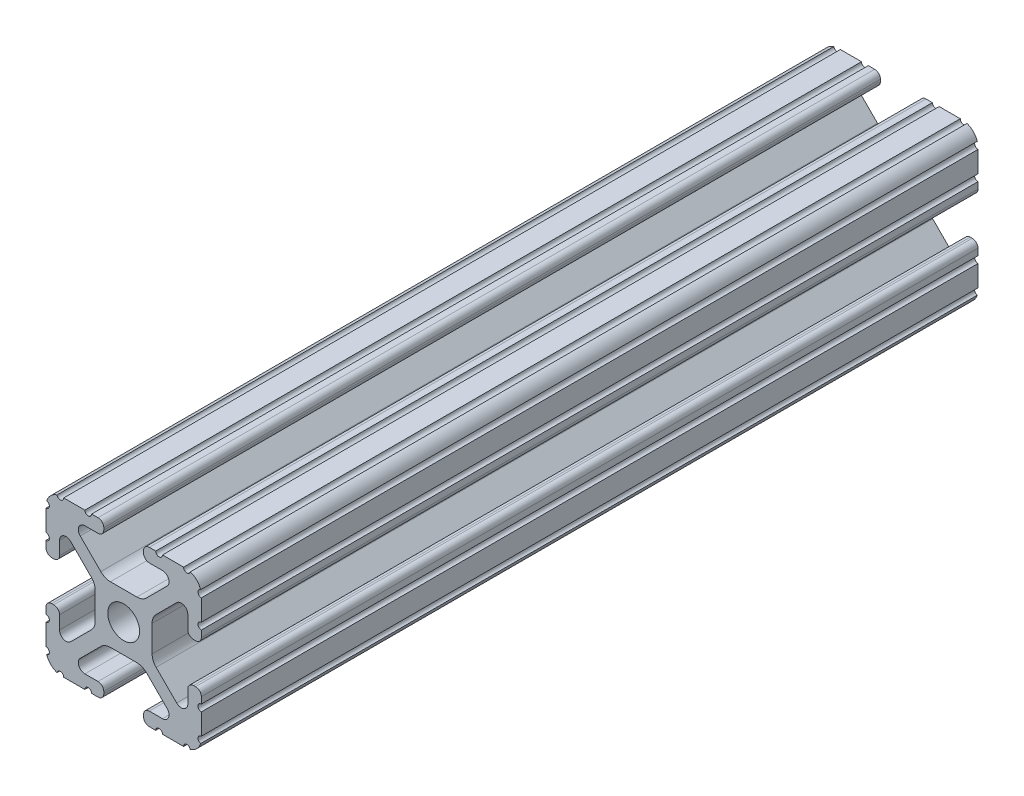
from build123d import *

# Parameters (mm, degrees)
BOSS_EXTRUDE1_DEPTH     = 63.5
CUT_EXTRUDE1_DEPTH      = 66.991135768
CUT_EXTRUDE1_DEPTH_BACK = 66.991135768
SKETCH5_R               = 0.55245


with BuildPart() as part:
    # Sketch4 → Boss-Extrude1 (new, symmetric)
    with BuildSketch(Plane.XY):
        with BuildLine():
            Line((4.190365, -12.7), (10.11729625, -12.7))
            ThreePointArc((10.11729625, -12.7), (11.943543585, -11.943543585), (12.7, -10.11729625))
            Line((12.7, -10.11729625), (12.7, -4.190365))
            ThreePointArc((12.7, -4.190365), (12.42492494, -3.52627506), (11.760835, -3.2512))
            Line((11.760835, -3.2512), (11.429365, -3.2512))
            ThreePointArc((11.429365, -3.2512), (10.76527506, -3.52627506), (10.4902, -4.190365))
            Line((10.4902, -4.190365), (10.4902, -6.348478019))
            ThreePointArc((10.4902, -6.348478019), (9.830707141, -7.335478831), (8.666460301, -7.103895736))
            Line((8.666460301, -7.103895736), (5.299899128, -3.737334563))
            ThreePointArc((5.299899128, -3.737334563), (4.817571085, -3.015479634), (4.6482, -2.16399369))
            Line((4.6482, -2.16399369), (4.6482, 0))
            Line((4.6482, 0), (2.6035, 0))
            ThreePointArc((2.6035, 0), (1.840952505, -1.840952505), (0, -2.6035))
            Line((0, -2.6035), (0, -4.6482))
            Line((0, -4.6482), (2.16399369, -4.6482))
            ThreePointArc((2.16399369, -4.6482), (3.015479634, -4.817571085), (3.737334563, -5.299899128))
            Line((3.737334563, -5.299899128), (7.103895736, -8.666460301))
            ThreePointArc((7.103895736, -8.666460301), (7.335478831, -9.830707141), (6.348478019, -10.4902))
            Line((6.348478019, -10.4902), (4.190365, -10.4902))
            ThreePointArc((4.190365, -10.4902), (3.52627506, -10.76527506), (3.2512, -11.429365))
            Line((3.2512, -11.429365), (3.2512, -11.760835))
            ThreePointArc((3.2512, -11.760835), (3.52627506, -12.42492494), (4.190365, -12.7))
        make_face()
    extrude(amount=BOSS_EXTRUDE1_DEPTH, both=True)

    # Sketch5 → Cut-Extrude1 (cut, two sides: drawn at the far end of the back side and taken through both)
    with BuildSketch(Plane.XY.offset(-CUT_EXTRUDE1_DEPTH_BACK)):
        with Locations((10.356153152, -12.7)):
            Circle(SKETCH5_R)
        with Locations((5.796028019, -12.7)):
            Circle(SKETCH5_R)
        with Locations((12.7, -10.356153152)):
            Circle(SKETCH5_R)
        with Locations((12.7, -5.796028019)):
            Circle(SKETCH5_R)
    extrude(amount=CUT_EXTRUDE1_DEPTH + CUT_EXTRUDE1_DEPTH_BACK, mode=Mode.SUBTRACT)

    # Mirror1: part across plane


with BuildPart() as part_1:
    add(part.part)
    add(part.part.mirror(Plane(origin=(0, 0, 0), x_dir=(0, 0, 1), z_dir=(1, 0, 0))))

    # Mirror2: part across plane


with BuildPart() as part_2:
    add(part_1.part)
    add(part_1.part.mirror(Plane.ZX))


solid = part_2.part
